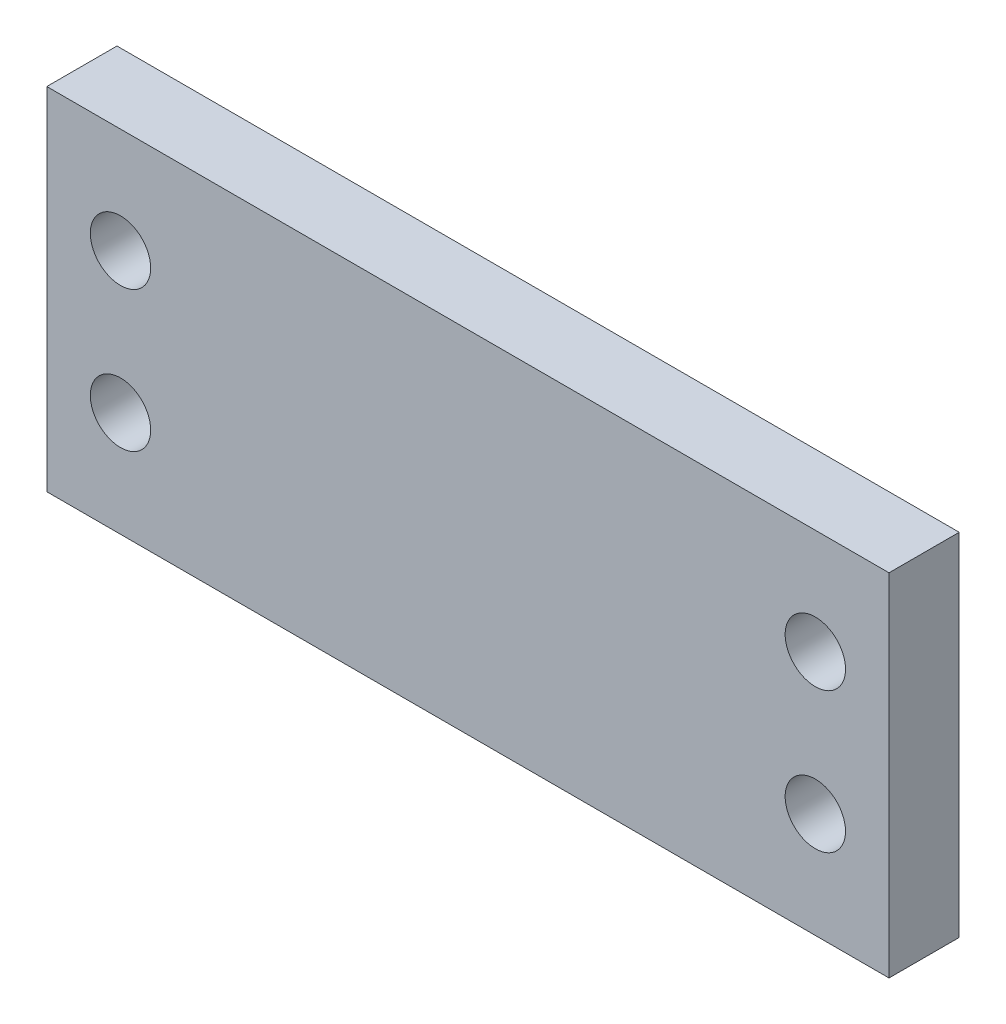
from build123d import *

# Parameters (mm, degrees)
SKETCH_1_W          = 60
SKETCH_1_H          = 25
EXTRUDE_1_DEPTH     = 5
SKETCH_2_R          = 2.15
CUT_EXTRUDE_1_DEPTH = 50


with BuildPart() as part:
    # 草图1 → 凸台-拉伸1 (new body)
    with BuildSketch(Plane.XY):
        Rectangle(SKETCH_1_W, SKETCH_1_H)
    extrude(amount=EXTRUDE_1_DEPTH)

    # 草图2 → 切除-拉伸1 (cut)
    with BuildSketch(Plane.XY.offset(5)):
        with Locations((-24.75, 5)):
            Circle(SKETCH_2_R)
        with Locations((-24.75, -5)):
            Circle(SKETCH_2_R)
        with Locations((24.75, 5)):
            Circle(SKETCH_2_R)
        with Locations((24.75, -5)):
            Circle(SKETCH_2_R)
    extrude(amount=-CUT_EXTRUDE_1_DEPTH, mode=Mode.SUBTRACT)


solid = part.part
